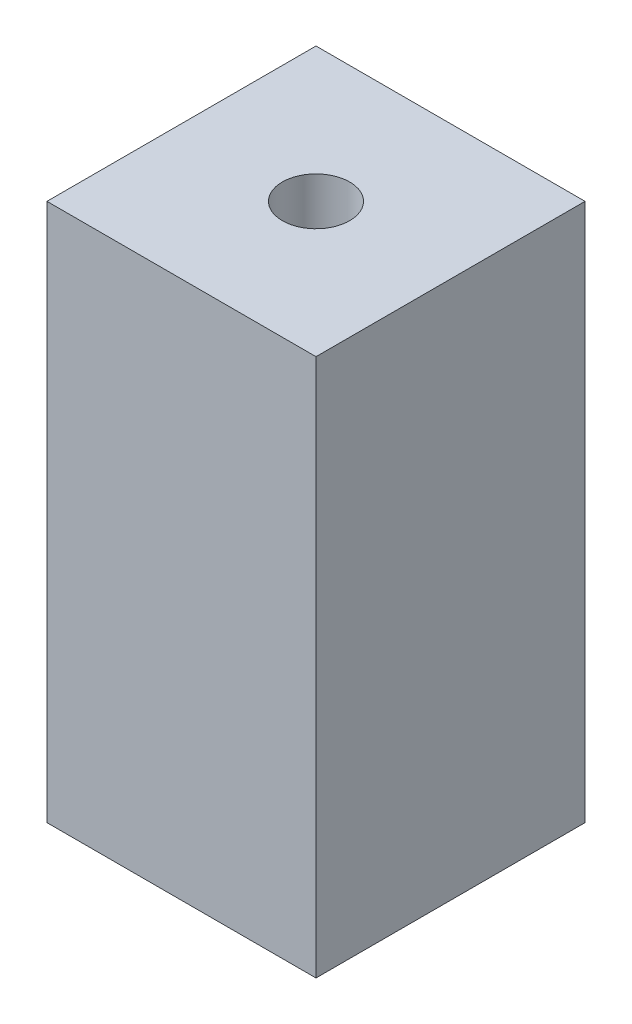
from build123d import *

# Parameters (mm, degrees)
SKETCH1_W           = 50.8
SKETCH1_H           = 50.8
BOSS_EXTRUDE1_DEPTH = 101.6
SKETCH2_R           = 6.35
CUT_EXTRUDE1_DEPTH  = 10


with BuildPart() as part:
    # Sketch1 → Boss-Extrude1 (new body)
    with BuildSketch(Plane(origin=(0, 0, 0), x_dir=(1, 0, 0), z_dir=(0, 1, 0))):
        Rectangle(SKETCH1_W, SKETCH1_H)
    extrude(amount=BOSS_EXTRUDE1_DEPTH)

    # Sketch2 → Cut-Extrude1 (cut)
    with BuildSketch(Plane(origin=(0, 101.6, 0), x_dir=(1, 0, 0), z_dir=(0, 1, 0))):
        with Locations(Location((0, 0, 0), (0, 0, 270))):
            Circle(SKETCH2_R)
    extrude(amount=-CUT_EXTRUDE1_DEPTH, mode=Mode.SUBTRACT)


solid = part.part
